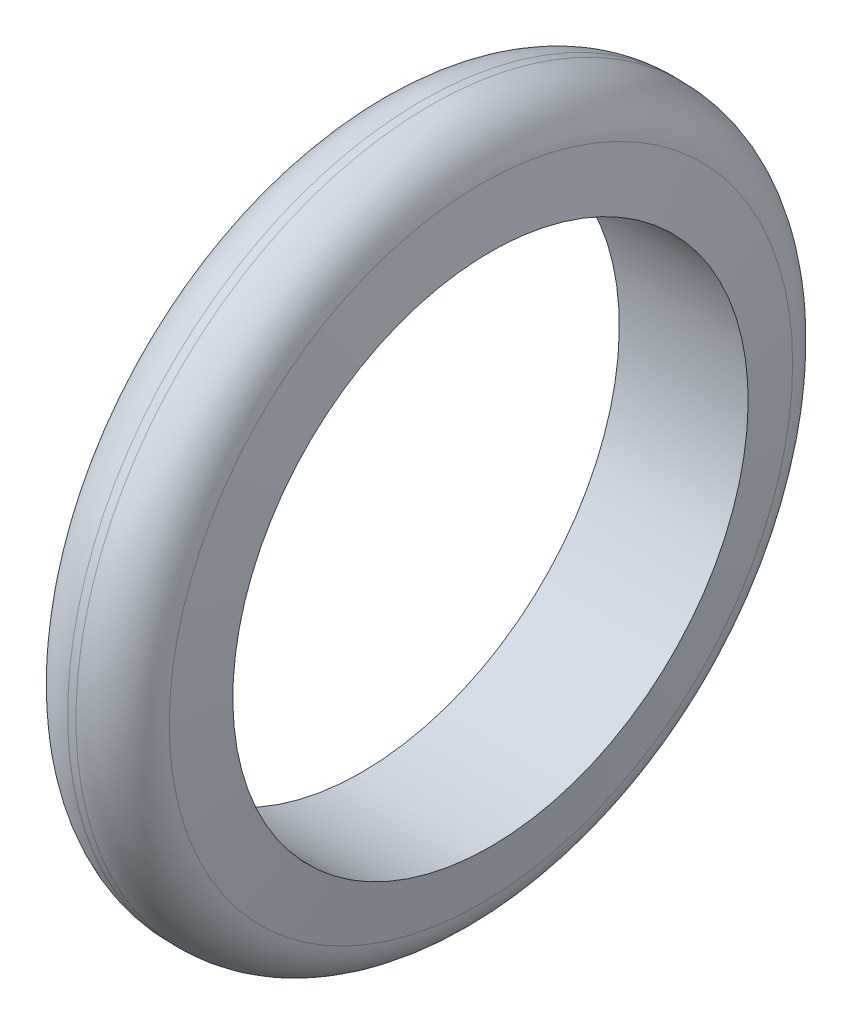
from build123d import *

# Parameters (mm, degrees)
FILLET1_R = 8


with BuildPart() as part:
    # Sketch2 → Revolve4 (revolve)
    with BuildSketch(Plane.XY, mode=Mode.PRIVATE) as revolve4_sk:
        Polygon((-7.355095289, 55), (7.355095289, 55), (10, 40), (-10, 40), align=None)
    revolve(revolve4_sk.sketch.rotate(Axis((0, 0, 0), (1, 0, 0)), 180), axis=Axis((0, 0, 0), (1, 0, 0)))

    # Fillet1
    fillet1_edges = [part.edges().sort_by_distance(p)[0] for p in [
        (-7.355095289, 55, 0),
        (7.355095289, 55, 0),
    ]]
    fillet(fillet1_edges, radius=FILLET1_R)


solid = part.part
